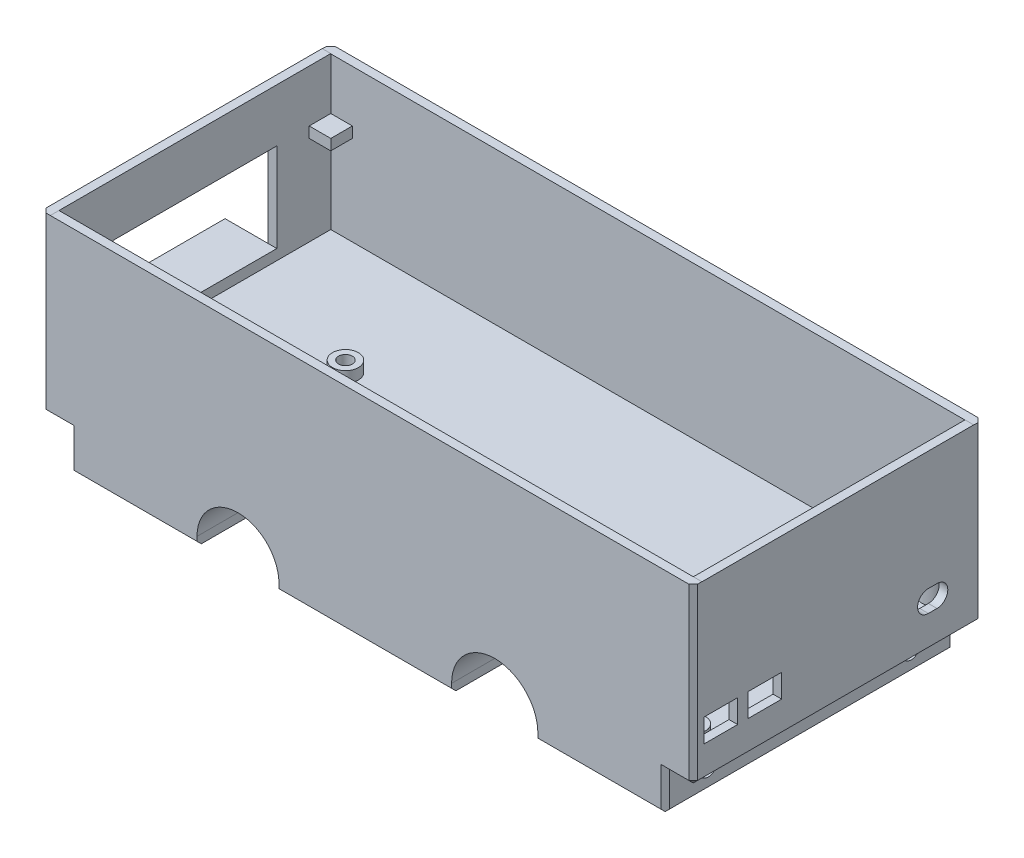
from build123d import *

# Parameters (mm, degrees)
AUFSATZ_LINEAR_AUSTRAGEN1_DEPTH  = 67
SKIZZE3_W                        = 151
SKIZZE3_H                        = 2
AUFSATZ_LINEAR_AUSTRAGEN2_DEPTH  = 47.34238026
SKIZZE4_W                        = 2
SKIZZE4_H                        = 65
AUFSATZ_LINEAR_AUSTRAGEN3_DEPTH  = 47.39811
SKIZZE6_W                        = 149
SKIZZE6_H                        = 2
AUFSATZ_LINEAR_AUSTRAGEN4_DEPTH  = 47.40101983
SKIZZE7_W                        = 2
SKIZZE7_H                        = 63
AUFSATZ_LINEAR_AUSTRAGEN5_DEPTH  = 47.37320267
SKIZZE20_W                       = 147
SKIZZE20_H                       = 12.080237494
AUFSATZ_LINEAR_AUSTRAGEN6_DEPTH  = 63
SCHNITT_LINEAR_AUSTRAGEN1_DEPTH  = 137.764615455
SKIZZE23_W                       = 7.8
SKIZZE23_H                       = 5.4
SCHNITT_LINEAR_AUSTRAGEN12_DEPTH = 47
SKIZZE26_R                       = 2.05
SCHNITT_LINEAR_AUSTRAGEN13_DEPTH = 38
SKIZZE28_R                       = 2.05
SCHNITT_LINEAR_AUSTRAGEN14_DEPTH = 38
SCHNITT_LINEAR_START             = -38
SKIZZE29_R                       = 2.05
SCHNITT_LINEAR_AUSTRAGEN15_DEPTH = 38
SKIZZE31_R                       = 2.05
SCHNITT_LINEAR_AUSTRAGEN16_DEPTH = 38
SKIZZE32_R                       = 3
AUFSATZ_LINEAR_AUSTRAGEN15_DEPTH = 23.29
SKIZZE33_R                       = 3
AUFSATZ_LINEAR_AUSTRAGEN16_DEPTH = 23.29
SKIZZE34_R                       = 1.65
SCHNITT_LINEAR_AUSTRAGEN17_DEPTH = 25
SKIZZE35_R                       = 1.65
SCHNITT_LINEAR_AUSTRAGEN18_DEPTH = 25
SKIZZE37_W                       = 67
SKIZZE37_H                       = 9
SCHNITT_LINEAR_AUSTRAGEN20_DEPTH = 6.5
SKIZZE38_W                       = 67
SKIZZE38_H                       = 9
SCHNITT_LINEAR_AUSTRAGEN21_DEPTH = 6.5
FASE2_SIZE                       = 1
FASE13_SIZE                      = 1
SKIZZE40_R                       = 2.85
AUFSATZ_LINEAR_AUSTRAGEN17_DEPTH = 1.5
SKIZZE41_R                       = 1.65
SCHNITT_LINEAR_AUSTRAGEN23_DEPTH = 5
SKIZZE42_R                       = 2.85
AUFSATZ_LINEAR_AUSTRAGEN18_DEPTH = 1.5
SCHNITT_LINEAR_AUSTRAGEN24_DEPTH = 2
SKIZZE46_W                       = 5
SKIZZE46_H                       = 2.5
AUFSATZ_LINEAR_AUSTRAGEN21_DEPTH = 5
SKIZZE47_W                       = 5
SKIZZE47_H                       = 2.5
AUFSATZ_LINEAR_AUSTRAGEN22_DEPTH = 5
SKIZZE48_W                       = 38
SKIZZE48_H                       = 20.6
SCHNITT_LINEAR_AUSTRAGEN25_DEPTH = 2
SKIZZE49_W                       = 38
SKIZZE49_H                       = 2
AUFSATZ_LINEAR_AUSTRAGEN23_DEPTH = 10
SKIZZE51_R                       = 3
AUFSATZ_LINEAR_AUSTRAGEN24_DEPTH = 2.5
SKIZZE52_R                       = 1.6
SCHNITT_LINEAR_AUSTRAGEN26_DEPTH = 15


with BuildPart() as part:
    # Skizze1 → Aufsatz-Linear austragen1 (new body)
    with BuildSketch(Plane.XY):
        with BuildLine():
            Line((13.401569275, 0), (13.401569275, -2))
            Line((13.401569275, -2), (53.401569275, -2))
            Line((53.401569275, -2), (53.401569275, 0))
            ThreePointArc((53.401569275, 0), (63.401569275, 10), (73.401569275, 0))
            Line((73.401569275, 0), (73.401569275, -2))
            Line((73.401569275, -2), (109.401569275, -2))
            Line((109.401569275, -2), (109.401569275, 0))
            Line((109.401569275, 0), (75.401569275, 0))
            ThreePointArc((75.401569275, 0), (63.401569275, 12), (51.401569275, 0))
            Line((51.401569275, 0), (15.488199501, 0))
            ThreePointArc((15.488199501, 0), (3.901569275, 8.877501001), (-7.685060952, 0))
            Line((-7.685060952, 0), (-41.598430725, 0))
            Line((-41.598430725, 0), (-41.598430725, -2))
            Line((-41.598430725, -2), (-5.598430725, -2))
            Line((-5.598430725, -2), (-5.598430725, 0))
            ThreePointArc((-5.598430725, 0), (3.901569275, 6.877501001), (13.401569275, 0))
        make_face()
    extrude(amount=AUFSATZ_LINEAR_AUSTRAGEN1_DEPTH)

    # Skizze3 → Aufsatz-Linear austragen2 (add)
    with BuildSketch(Plane(origin=(0, 0, 0), x_dir=(1, 0, 0), z_dir=(0, 1, 0))):
        with Locations((33.901569275, -1)):
            Rectangle(SKIZZE3_W, SKIZZE3_H)
    extrude(amount=AUFSATZ_LINEAR_AUSTRAGEN2_DEPTH)

    # Skizze4 → Aufsatz-Linear austragen3 (add)
    with BuildSketch(Plane(origin=(0, 0, 0), x_dir=(1, 0, 0), z_dir=(0, 1, 0))):
        with Locations((-40.598430725, -34.5)):
            Rectangle(SKIZZE4_W, SKIZZE4_H)
    extrude(amount=AUFSATZ_LINEAR_AUSTRAGEN3_DEPTH)

    # Skizze6 → Aufsatz-Linear austragen4 (add)
    with BuildSketch(Plane(origin=(0, 0, 0), x_dir=(1, 0, 0), z_dir=(0, 1, 0))):
        with Locations((34.901569275, -66)):
            Rectangle(SKIZZE6_W, SKIZZE6_H)
    extrude(amount=AUFSATZ_LINEAR_AUSTRAGEN4_DEPTH)

    # Skizze7 → Aufsatz-Linear austragen5 (add)
    with BuildSketch(Plane(origin=(0, 0, 0), x_dir=(1, 0, 0), z_dir=(0, 1, 0))):
        with Locations((108.401569275, -33.5)):
            Rectangle(SKIZZE7_W, SKIZZE7_H)
    extrude(amount=AUFSATZ_LINEAR_AUSTRAGEN5_DEPTH)

    # Skizze20 → Aufsatz-Linear austragen6 (add)
    with BuildSketch(Plane.XY.offset(2)):
        with Locations((33.901569275, 6.040118747)):
            Rectangle(SKIZZE20_W, SKIZZE20_H)
    extrude(amount=AUFSATZ_LINEAR_AUSTRAGEN6_DEPTH)

    # Skizze8 → Schnitt-Linear austragen1 (cut, through all)
    with BuildSketch(Plane.XY.offset(67)):
        with BuildLine():
            Line((53.401569275, 0), (73.401569275, 0))
            ThreePointArc((73.401569275, 0), (63.401569275, 10), (53.401569275, 0))
        make_face()
        with BuildLine():
            Line((-5.598430725, 0), (13.401569275, 0))
            ThreePointArc((13.401569275, 0), (3.901569275, 9.5), (-5.598430725, 0))
        make_face()
    extrude(amount=-SCHNITT_LINEAR_AUSTRAGEN1_DEPTH, mode=Mode.SUBTRACT)

    # Skizze23 → Schnitt-Linear austragen12 (cut)
    with BuildSketch(Plane(origin=(109.401569275, 0, 0), x_dir=(0, 0, -1), z_dir=(1, 0, 0))):
        with Locations((-60.6, 17.280237494)):
            Rectangle(SKIZZE23_W, SKIZZE23_H)
        with Locations((-50.4, 17.280237494)):
            Rectangle(SKIZZE23_W, SKIZZE23_H)
    extrude(amount=-SCHNITT_LINEAR_AUSTRAGEN12_DEPTH, mode=Mode.SUBTRACT)

    # Skizze26 → Schnitt-Linear austragen13 (cut)
    with BuildSketch(Plane(origin=(109.401569275, 0, 0), x_dir=(0, 0, -1), z_dir=(1, 0, 0))):
        with Locations((-57, 3)):
            Circle(SKIZZE26_R)
    extrude(amount=-SCHNITT_LINEAR_AUSTRAGEN13_DEPTH, mode=Mode.SUBTRACT)

    # Skizze28 → Schnitt-Linear austragen14 (cut)
    with BuildSketch(Plane(origin=(109.401569275, 0, 0), x_dir=(0, 0, -1), z_dir=(1, 0, 0))):
        with Locations((-10, 3)):
            Circle(SKIZZE28_R)
    extrude(amount=-SCHNITT_LINEAR_AUSTRAGEN14_DEPTH, mode=Mode.SUBTRACT)

    # Skizze29 → Schnitt-Linear austragen15 (cut)
    with BuildSketch(Plane.ZY.offset(41.598430725).offset(SCHNITT_LINEAR_START)):
        with Locations(Location((57, 3, 0), (0, 0, 180))):
            Circle(SKIZZE29_R)
    extrude(amount=SCHNITT_LINEAR_AUSTRAGEN15_DEPTH, mode=Mode.SUBTRACT)

    # Skizze31 → Schnitt-Linear austragen16 (cut)
    with BuildSketch(Plane.ZY.offset(41.598430725).offset(SCHNITT_LINEAR_START)):
        with Locations(Location((10, 3, 0), (0, 0, 180))):
            Circle(SKIZZE31_R)
    extrude(amount=SCHNITT_LINEAR_AUSTRAGEN16_DEPTH, mode=Mode.SUBTRACT)

    # Skizze32 → Aufsatz-Linear austragen15 (add)
    with BuildSketch(Plane(origin=(0, 12.080237494, 0), x_dir=(1, 0, 0), z_dir=(0, 1, 0))):
        with Locations((-36.098430725, -61.5)):
            Circle(SKIZZE32_R)
    extrude(amount=AUFSATZ_LINEAR_AUSTRAGEN15_DEPTH)

    # Skizze33 → Aufsatz-Linear austragen16 (add)
    with BuildSketch(Plane(origin=(0, 12.080237494, 0), x_dir=(1, 0, 0), z_dir=(0, 1, 0))):
        with Locations((103.901569275, -5.5)):
            Circle(SKIZZE33_R)
    extrude(amount=AUFSATZ_LINEAR_AUSTRAGEN16_DEPTH)

    # Skizze34 → Schnitt-Linear austragen17 (cut)
    with BuildSketch(Plane(origin=(0, 35.370237494, 0), x_dir=(1, 0, 0), z_dir=(0, 1, 0))):
        with Locations(Location((-36.098430725, -61.5, 0), (0, 0, 180))):
            Circle(SKIZZE34_R)
    extrude(amount=-SCHNITT_LINEAR_AUSTRAGEN17_DEPTH, mode=Mode.SUBTRACT)

    # Skizze35 → Schnitt-Linear austragen18 (cut)
    with BuildSketch(Plane(origin=(0, 35.370237494, 0), x_dir=(1, 0, 0), z_dir=(0, 1, 0))):
        with Locations(Location((103.901569275, -5.5, 0), (0, 0, 180))):
            Circle(SKIZZE35_R)
    extrude(amount=-SCHNITT_LINEAR_AUSTRAGEN18_DEPTH, mode=Mode.SUBTRACT)

    # Skizze37 → Schnitt-Linear austragen20 (cut)
    with BuildSketch(Plane(origin=(109.401569275, 0, 0), x_dir=(0, 0, -1), z_dir=(1, 0, 0))):
        with Locations((-33.5, 2.5)):
            Rectangle(SKIZZE37_W, SKIZZE37_H)
    extrude(amount=-SCHNITT_LINEAR_AUSTRAGEN20_DEPTH, mode=Mode.SUBTRACT)

    # Skizze38 → Schnitt-Linear austragen21 (cut)
    with BuildSketch(Plane.ZY.offset(41.598430725)):
        with Locations((33.5, 2.5)):
            Rectangle(SKIZZE38_W, SKIZZE38_H)
    extrude(amount=-SCHNITT_LINEAR_AUSTRAGEN21_DEPTH, mode=Mode.SUBTRACT)

    # Fase2
    fase2_edges = [part.edges().sort_by_distance(p)[0] for p in [
        (-41.598430725, 27.17119013, 0),
        (109.401569275, 27.17119013, 0),
        (109.401569275, 27.200509915, 67),
        (109.401569275, 7, 33.5),
        (102.901569275, 2.5, 67),
        (106.151569275, 7, 67),
        (102.901569275, 2.5, 0),
        (106.151569275, 7, 0),
        (102.901569275, -2, 33.5),
        (-41.598430725, 7, 33.5),
        (-35.098430725, 2.5, 0),
        (-38.348430725, 7, 0),
        (-35.098430725, 2.5, 67),
        (-38.348430725, 7, 67),
        (-35.098430725, -2, 33.5),
        (-41.598430725, 27.199055, 67),
    ]]
    chamfer(fase2_edges, length=FASE2_SIZE)

    # Fase13
    fase13_edges = [part.edges().sort_by_distance(p)[0] for p in [
        (33.401569275, -2, 67),
        (87.651569275, -2, 0),
        (33.401569275, -2, 0),
        (87.651569275, -2, 67),
        (-19.848430725, -2, 0),
        (-19.848430725, -2, 67),
    ]]
    chamfer(fase13_edges, length=FASE13_SIZE)

    # Skizze40 → Aufsatz-Linear austragen17 (add)
    with BuildSketch(Plane(origin=(0, 12.080237494, 0), x_dir=(1, 0, 0), z_dir=(0, 1, 0))):
        with Locations((103.091569275, -37.57)):
            Circle(SKIZZE40_R)
    extrude(amount=AUFSATZ_LINEAR_AUSTRAGEN17_DEPTH)

    # Skizze41 → Schnitt-Linear austragen23 (cut)
    with BuildSketch(Plane(origin=(0, 13.580237494, 0), x_dir=(1, 0, 0), z_dir=(0, 1, 0))):
        with Locations(Location((103.091569275, -37.59, 0), (0, 0, 180))):
            Circle(SKIZZE41_R)
    extrude(amount=-SCHNITT_LINEAR_AUSTRAGEN23_DEPTH, mode=Mode.SUBTRACT)

    # Skizze42 → Aufsatz-Linear austragen18 (add)
    with BuildSketch(Plane(origin=(0, 12.080237494, 0), x_dir=(1, 0, 0), z_dir=(0, 1, 0))):
        with Locations((103.091569275, -60.69)):
            Circle(SKIZZE42_R)
        with Locations((68.201569275, -60.69)):
            Circle(SKIZZE42_R)
    extrude(amount=AUFSATZ_LINEAR_AUSTRAGEN18_DEPTH)

    # Skizze43 → Schnitt-Linear austragen24 (cut)
    with BuildSketch(Plane(origin=(109.401569275, 0, 0), x_dir=(0, 0, -1), z_dir=(1, 0, 0))):
        with BuildLine():
            Line((-12.5, 19.780237494), (-10.5, 19.780237494))
            ThreePointArc((-10.5, 19.780237494), (-8, 17.280237494), (-10.5, 14.780237494))
            Line((-10.5, 14.780237494), (-12.5, 14.780237494))
            ThreePointArc((-12.5, 14.780237494), (-15, 17.280237494), (-12.5, 19.780237494))
        make_face()
    extrude(amount=-SCHNITT_LINEAR_AUSTRAGEN24_DEPTH, mode=Mode.SUBTRACT)

    # Skizze46 → Aufsatz-Linear austragen21 (add)
    with BuildSketch(Plane(origin=(-39.598430725, 0, 0), x_dir=(0, 0, -1), z_dir=(1, 0, 0))):
        with Locations((-4.5, 34.120237494)):
            Rectangle(SKIZZE46_W, SKIZZE46_H)
    extrude(amount=AUFSATZ_LINEAR_AUSTRAGEN21_DEPTH)

    # Skizze47 → Aufsatz-Linear austragen22 (add)
    with BuildSketch(Plane.ZY.offset(-107.401569275)):
        with Locations((62.5, 34.120237494)):
            Rectangle(SKIZZE47_W, SKIZZE47_H)
    extrude(amount=AUFSATZ_LINEAR_AUSTRAGEN22_DEPTH)

    # Skizze48 → Schnitt-Linear austragen25 (cut)
    with BuildSketch(Plane.ZY.offset(41.598430725)):
        with Locations((33.5, 24.82)):
            Rectangle(SKIZZE48_W, SKIZZE48_H)
    extrude(amount=-SCHNITT_LINEAR_AUSTRAGEN25_DEPTH, mode=Mode.SUBTRACT)

    # Skizze49 → Aufsatz-Linear austragen23 (add)
    with BuildSketch(Plane.ZY.offset(41.598430725)):
        with Locations((33.5, 13.52)):
            Rectangle(SKIZZE49_W, SKIZZE49_H)
    extrude(amount=AUFSATZ_LINEAR_AUSTRAGEN23_DEPTH)

    # Skizze51 → Aufsatz-Linear austragen24 (add)
    with BuildSketch(Plane(origin=(0, 12.080237494, 0), x_dir=(1, 0, 0), z_dir=(0, 1, 0))):
        with Locations((-9.198430725, -29)):
            Circle(SKIZZE51_R)
    extrude(amount=AUFSATZ_LINEAR_AUSTRAGEN24_DEPTH)

    # Skizze52 → Schnitt-Linear austragen26 (cut)
    with BuildSketch(Plane(origin=(0, 14.580237494, 0), x_dir=(1, 0, 0), z_dir=(0, 1, 0))):
        with Locations(Location((-9.198430725, -29, 0), (0, 0, 180))):
            Circle(SKIZZE52_R)
    extrude(amount=-SCHNITT_LINEAR_AUSTRAGEN26_DEPTH, mode=Mode.SUBTRACT)


solid = part.part
